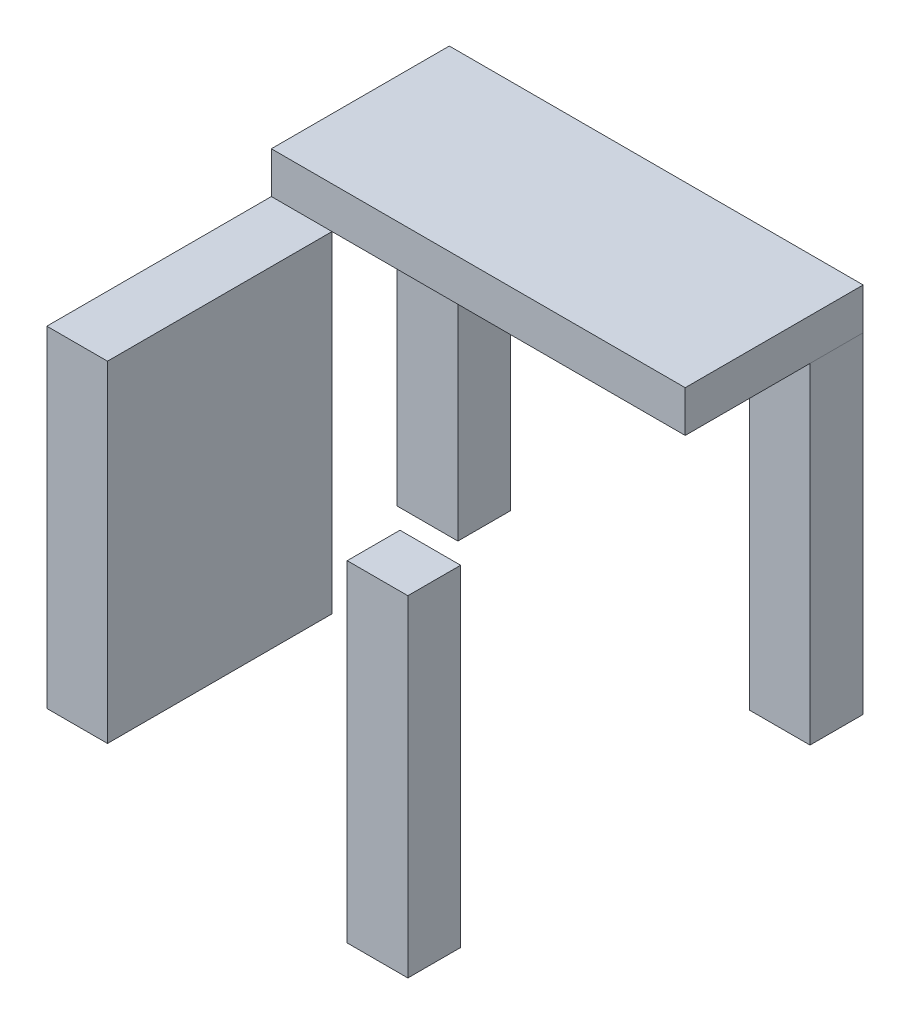
from build123d import *

# Parameters (mm, degrees)
SKETCH1_W           = 100
SKETCH1_H           = 10
BOSS_EXTRUDE1_DEPTH = 43
SKETCH2_W           = 14.657296337
SKETCH2_H           = 12.750406224
SKETCH2_H_2         = 54.249593776
SKETCH2_W_2         = 14.657296336
BOSS_EXTRUDE2_DEPTH = 80


with BuildPart() as part:
    # Sketch1 → Boss-Extrude1 (new body)
    with BuildSketch(Plane.XY):
        with Locations((50, 5)):
            Rectangle(SKETCH1_W, SKETCH1_H)
    extrude(amount=BOSS_EXTRUDE1_DEPTH)

    # Sketch2 → Boss-Extrude2 (add)
    with BuildSketch(Plane.XZ):
        with Locations((92.690459103, 103.659485129)):
            Rectangle(SKETCH2_W, SKETCH2_H)
        with Locations((7.328648169, 70.124796888)):
            Rectangle(SKETCH2_W, SKETCH2_H_2)
        with Locations((7.309540898, 6.193559762)):
            Rectangle(SKETCH2_W, SKETCH2_H)
        with Locations((92.543503994, 6.340514871)):
            Rectangle(SKETCH2_W_2, SKETCH2_H)
    extrude(amount=BOSS_EXTRUDE2_DEPTH)


with BuildPart() as boss_extrude2_piece_1:
    # of the separate pieces the step leaves, piece 1, a body of its own (boss_extrude2_pieces)
    add(part.part.solids().sort_by_distance((0, 0, 12.568762874))[0])


with BuildPart() as boss_extrude2_piece_2:
    # of the separate pieces the step leaves, piece 2, a body of its own (boss_extrude2_pieces)
    add(part.part.solids().sort_by_distance((0, -80, 43))[0])


with BuildPart() as boss_extrude2_piece_3:
    # of the separate pieces the step leaves, piece 3, a body of its own (boss_extrude2_pieces)
    add(part.part.solids().sort_by_distance((85.361810934, 0, 110.034688241))[0])


solid = Compound([boss_extrude2_piece_1.part, boss_extrude2_piece_2.part, boss_extrude2_piece_3.part])
